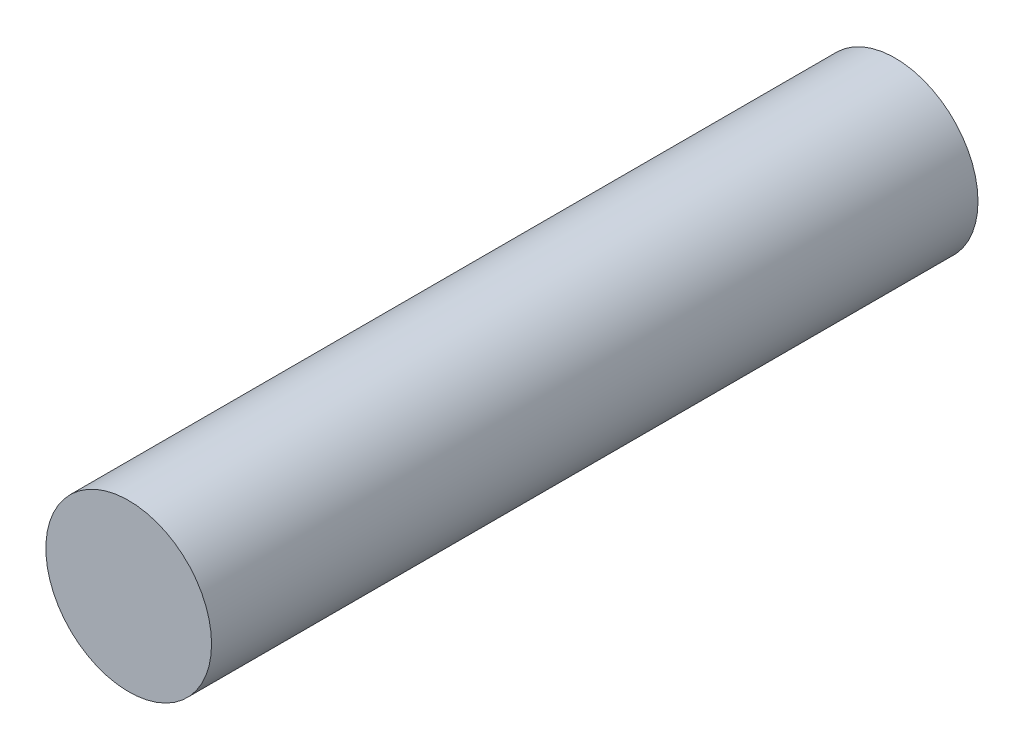
from build123d import *

# Parameters (mm, degrees)
SKETCH_1_R      = 4
EXTRUDE_1_DEPTH = 37


with BuildPart() as part:
    # 草图1 → 凸台-拉伸1 (new body)
    with BuildSketch(Plane.XY):
        Circle(SKETCH_1_R)
    extrude(amount=EXTRUDE_1_DEPTH)


solid = part.part
